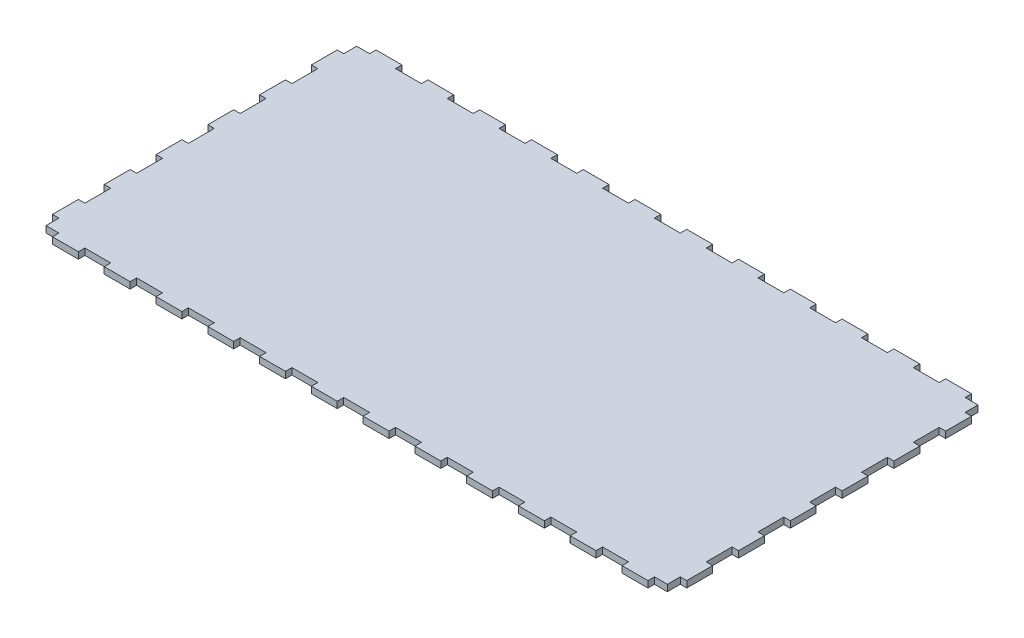
from build123d import *

# Parameters (mm, degrees)
BOSS_EXTRUDE1_DEPTH = 6.35


with BuildPart() as part:
    # Sketch2 → Boss-Extrude1 (new body)
    with BuildSketch(Plane(origin=(0, 0, 0), x_dir=(1, 0, 0), z_dir=(0, 1, 0))):
        Polygon((-292.1, 152.4), (-292.1, 158.75), (-266.7, 158.75), (-266.7, 152.4), (-241.3, 152.4), (-241.3, 158.75), (-215.9, 158.75), (-215.9, 152.4), (-190.5, 152.4), (-190.5, 158.75), (-165.1, 158.75), (-165.1, 152.4), (-139.7, 152.4), (-139.7, 158.75), (-114.3, 158.75), (-114.3, 152.4), (-88.9, 152.4), (-88.9, 158.75), (-63.5, 158.75), (-63.5, 152.4), (-38.1, 152.4), (-38.1, 158.75), (-12.7, 158.75), (-12.7, 152.4), (12.7, 152.4), (12.7, 158.75), (38.1, 158.75), (38.1, 152.4), (63.5, 152.4), (63.5, 158.75), (88.9, 158.75), (88.9, 152.4), (114.3, 152.4), (114.3, 158.75), (139.7, 158.75), (139.7, 152.4), (165.1, 152.4), (165.1, 158.75), (190.5, 158.75), (190.5, 152.4), (215.9, 152.4), (215.9, 158.75), (241.3, 158.75), (241.3, 152.4), (266.7, 152.4), (266.7, 158.75), (292.1, 158.75), (292.1, 152.4), (304.8, 152.4), (304.8, 139.7), (311.15, 139.7), (311.15, 114.3), (304.8, 114.3), (304.8, 88.9), (311.15, 88.9), (311.15, 63.5), (304.8, 63.5), (304.8, 38.1), (311.15, 38.1), (311.15, 12.7), (304.8, 12.7), (304.8, -12.7), (311.15, -12.7), (311.15, -38.1), (304.8, -38.1), (304.8, -63.5), (311.15, -63.5), (311.15, -88.9), (304.8, -88.9), (304.8, -114.3), (311.15, -114.3), (311.15, -139.7), (304.8, -139.7), (304.8, -152.4), (292.1, -152.4), (292.1, -158.75), (266.7, -158.75), (266.7, -152.4), (241.3, -152.4), (241.3, -158.75), (215.9, -158.75), (215.9, -152.4), (190.5, -152.4), (190.5, -158.75), (165.1, -158.75), (165.1, -152.4), (139.7, -152.4), (139.7, -158.75), (114.3, -158.75), (114.3, -152.4), (88.9, -152.4), (88.9, -158.75), (63.5, -158.75), (63.5, -152.4), (38.1, -152.4), (38.1, -158.75), (12.7, -158.75), (12.7, -152.4), (-12.7, -152.4), (-12.7, -158.75), (-38.1, -158.75), (-38.1, -152.4), (-63.5, -152.4), (-63.5, -158.75), (-88.9, -158.75), (-88.9, -152.4), (-114.3, -152.4), (-114.3, -158.75), (-139.7, -158.75), (-139.7, -152.4), (-165.1, -152.4), (-165.1, -158.75), (-190.5, -158.75), (-190.5, -152.4), (-215.9, -152.4), (-215.9, -158.75), (-241.3, -158.75), (-241.3, -152.4), (-266.7, -152.4), (-266.7, -158.75), (-292.1, -158.75), (-292.1, -152.4), (-304.8, -152.4), (-304.8, -139.7), (-311.15, -139.7), (-311.15, -114.3), (-304.8, -114.3), (-304.8, -88.9), (-311.15, -88.9), (-311.15, -63.5), (-304.8, -63.5), (-304.8, -38.1), (-311.15, -38.1), (-311.15, -12.7), (-304.8, -12.7), (-304.8, 12.7), (-311.15, 12.7), (-311.15, 38.1), (-304.8, 38.1), (-304.8, 63.5), (-311.15, 63.5), (-311.15, 88.9), (-304.8, 88.9), (-304.8, 114.3), (-311.15, 114.3), (-311.15, 139.7), (-304.8, 139.7), (-304.8, 152.4), align=None)
    extrude(amount=BOSS_EXTRUDE1_DEPTH)


solid = part.part
